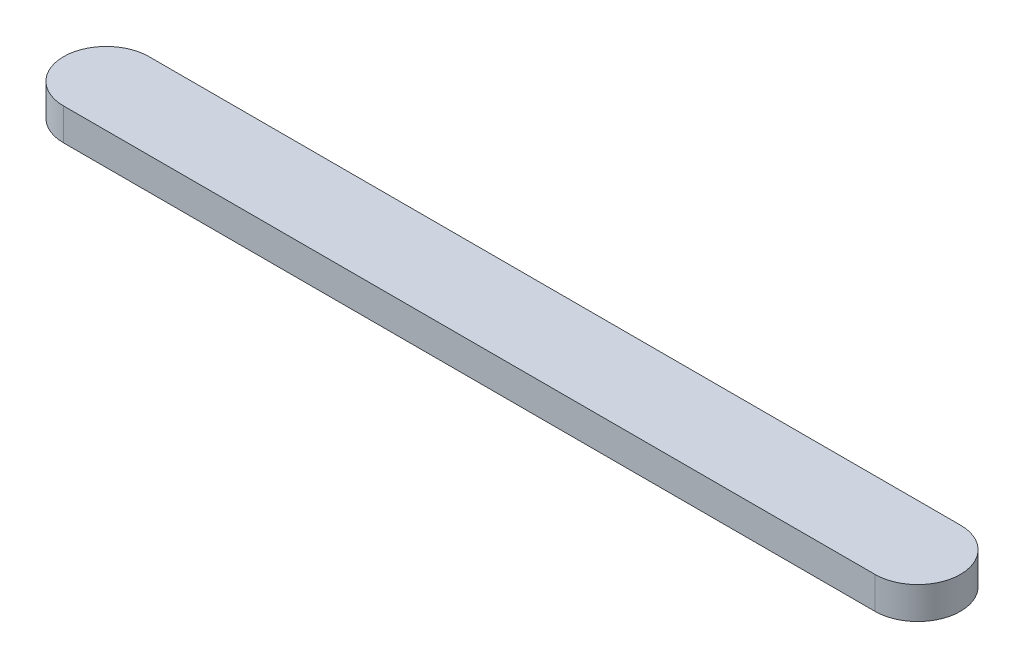
from build123d import *

# Parameters (mm, degrees)
BOSS_EXTRUDE1_DEPTH = 3


with BuildPart() as part:
    # Sketch1 → Boss-Extrude1 (new body)
    with BuildSketch(Plane(origin=(0, 0, 0), x_dir=(1, 0, 0), z_dir=(0, 1, 0))):
        with BuildLine():
            Line((0, 4), (76, 4))
            ThreePointArc((76, 4), (80, 0), (76, -4))
            Line((76, -4), (0, -4))
            ThreePointArc((0, -4), (-4, 0), (0, 4))
        make_face()
    extrude(amount=BOSS_EXTRUDE1_DEPTH)


solid = part.part
